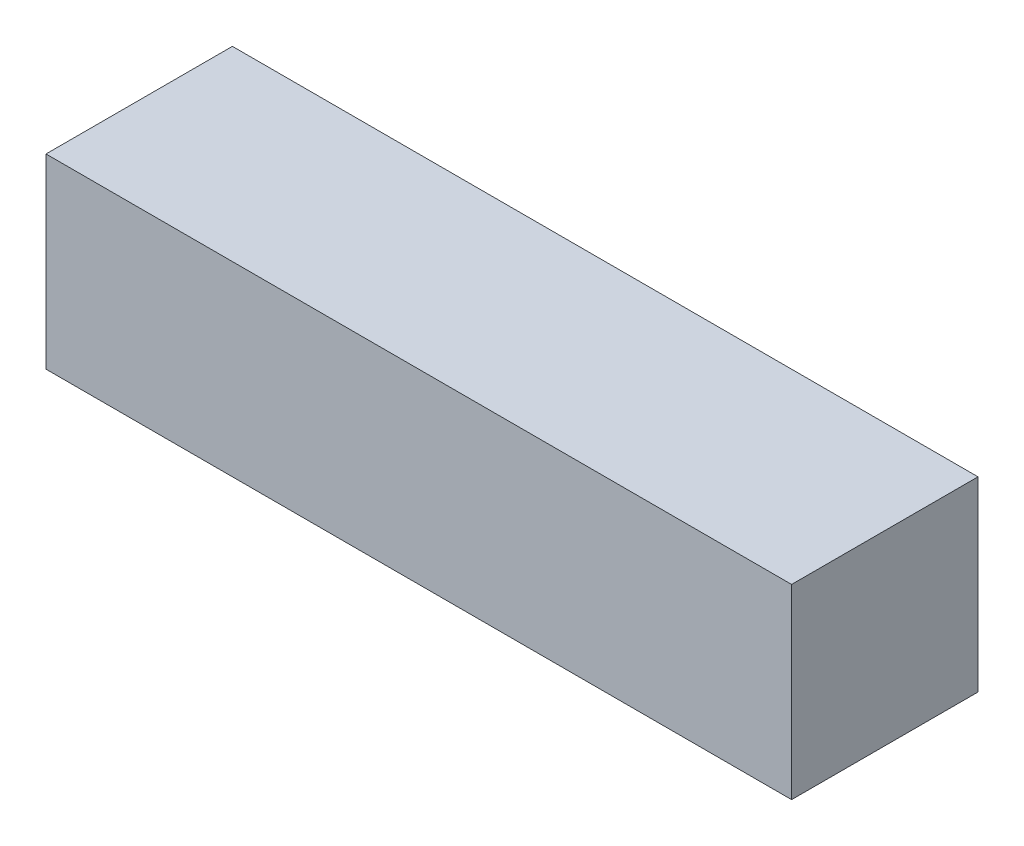
from build123d import *

# Parameters (mm, degrees)
SKETCH2_W           = 20
SKETCH2_H           = 5
BOSS_EXTRUDE1_DEPTH = 5


with BuildPart() as part:
    # Sketch2 → Boss-Extrude1 (new body)
    with BuildSketch(Plane(origin=(0, 0, 0), x_dir=(1, 0, 0), z_dir=(0, 1, 0))):
        Rectangle(SKETCH2_W, SKETCH2_H)
    extrude(amount=BOSS_EXTRUDE1_DEPTH)


solid = part.part
